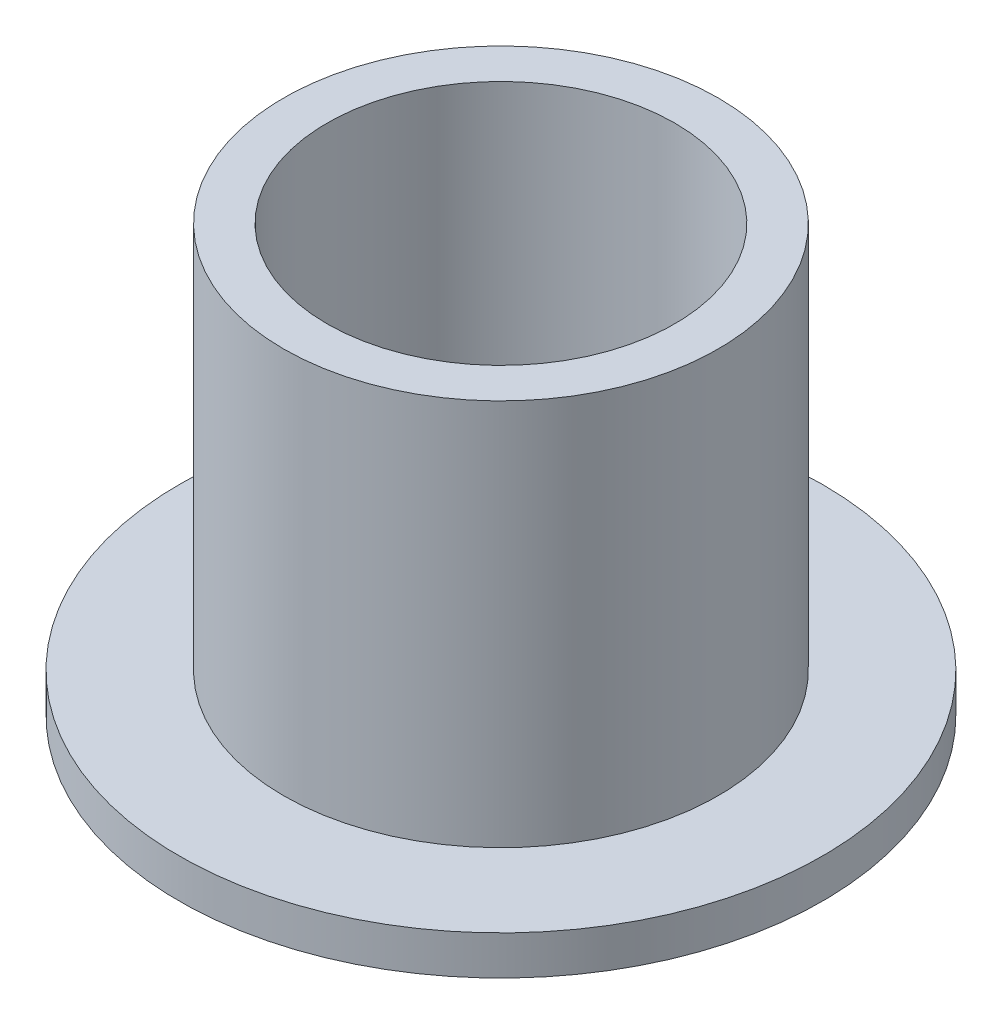
from build123d import *


with BuildPart() as part:
    # Sketch1 → Revolve1 (revolve)
    with BuildSketch(Plane.XY, mode=Mode.PRIVATE) as revolve1_sk:
        Polygon((-4, 0), (-7.4, 0), (-7.4, 0.9), (-5, 0.9), (-5, 9.8), (-4, 9.8), align=None)
    revolve(revolve1_sk.sketch.rotate(Axis((0, 0, 0), (0, 1, 0)), 270), axis=Axis((0, 0, 0), (0, 1, 0)))


solid = part.part
